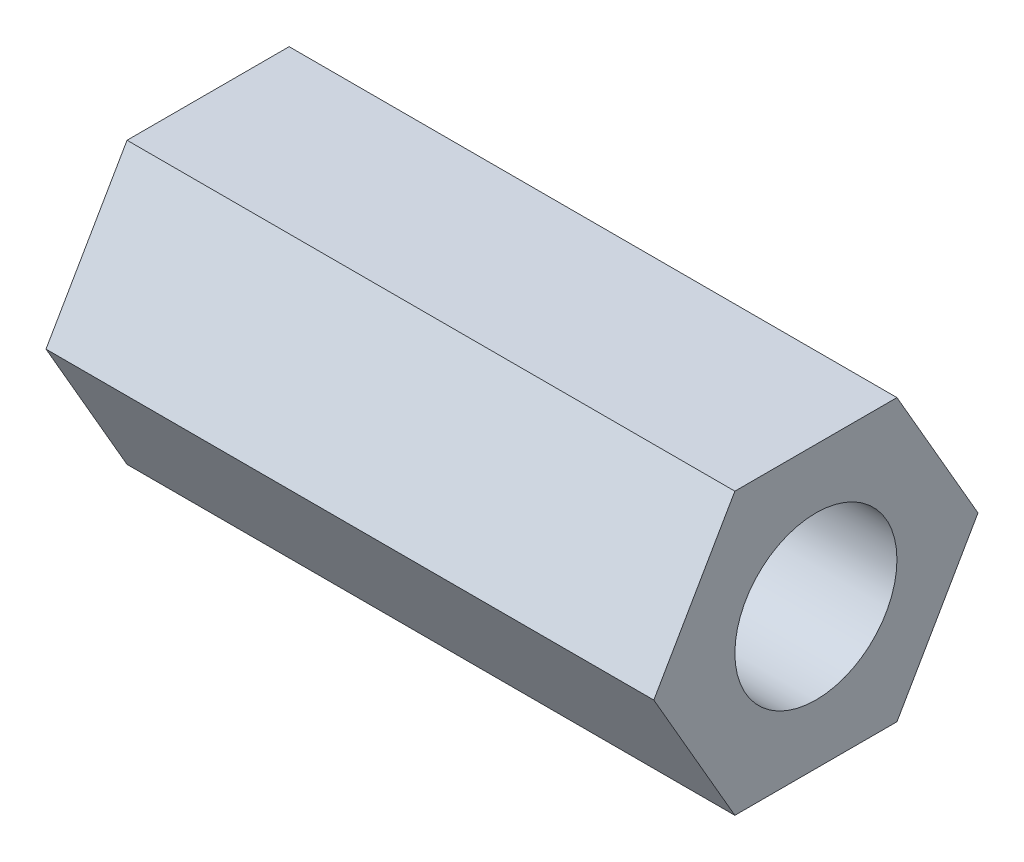
from build123d import *

# Parameters (mm, degrees)
SKETCH_1_R      = 2
EXTRUDE_1_DEPTH = 15


with BuildPart() as part:
    # 草图1 → 凸台-拉伸1 (new body)
    with BuildSketch(Plane(origin=(0, 0, 0), x_dir=(0, 0, -1), z_dir=(1, 0, 0))):
        Polygon((-4, 0), (-2, -3.464101615), (2, -3.464101615), (4, 0), (2, 3.464101615), (-2, 3.464101615), align=None)
        Circle(SKETCH_1_R, mode=Mode.SUBTRACT)
    extrude(amount=EXTRUDE_1_DEPTH)


solid = part.part
